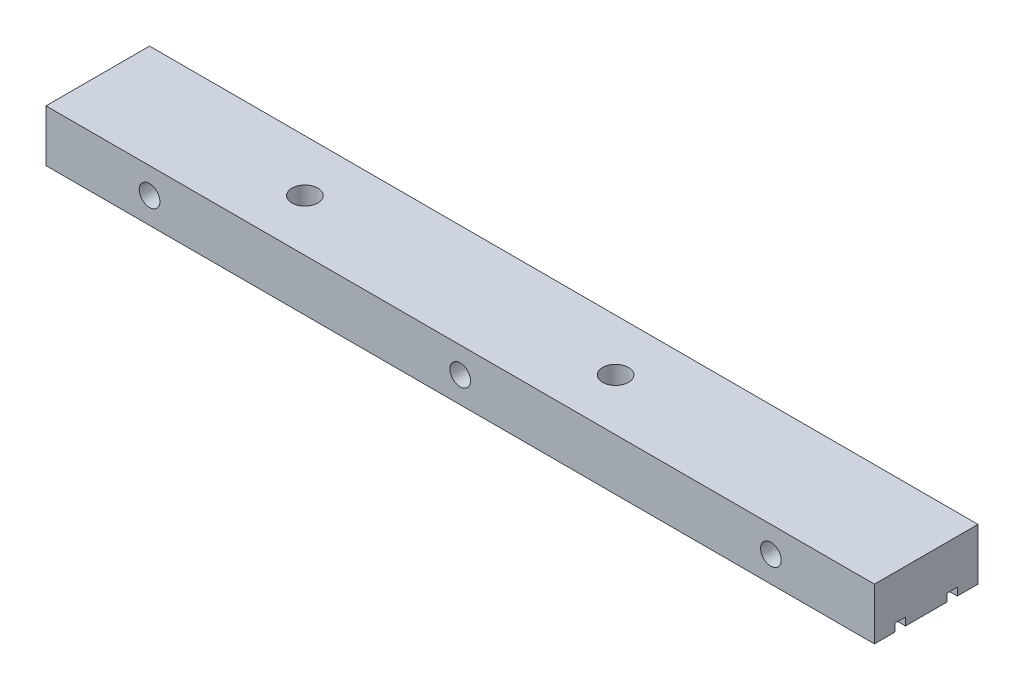
from build123d import *

# Parameters (mm, degrees)
IZIM1_W                                      = 160
IZIM1_H                                      = 10
Y_KSEKLIK_EKSTR_ZYON1_DEPTH                  = 20
F_4_0MM_SAPLAMA_DELIKLERI1_D                 = 5
F_4_0MM_SAPLAMA_DELIKLERI1_DEPTH             = 8
IZIM6_W                                      = 2
IZIM6_H                                      = 1.5
KES_EKSTR_ZYON1_DEPTH                        = 162.554944214
M5_ALT_GEN_BA_L_C_VATA_IN_HAV_A1_D           = 4
M5_ALT_GEN_BA_L_C_VATA_IN_HAV_A1_CBORE_D     = 6.5
M5_ALT_GEN_BA_L_C_VATA_IN_HAV_A1_CBORE_DEPTH = 6


with BuildPart() as part:
    # Çizim1 → Yükseklik-Ekstrüzyon1 (new body)
    with BuildSketch(Plane.XY):
        with Locations((80, 5)):
            Rectangle(IZIM1_W, IZIM1_H)
    extrude(amount=Y_KSEKLIK_EKSTR_ZYON1_DEPTH)

    # Ø4.0mm Saplama Delikleri1
    with Locations(Plane(origin=(40, 10, 10), x_dir=(0, 0, 1), z_dir=(0, 1, 0))):
        with Locations((0, 0), (0, 60)):
            Hole(F_4_0MM_SAPLAMA_DELIKLERI1_D / 2, depth=F_4_0MM_SAPLAMA_DELIKLERI1_DEPTH)

    # Çizim6 → Kes-Ekstrüzyon1 (cut, through all)
    with BuildSketch(Plane.ZY):
        with Locations((5, 0.75)):
            Rectangle(IZIM6_W, IZIM6_H)
        with Locations((15, 0.75)):
            Rectangle(IZIM6_W, IZIM6_H)
    extrude(amount=-KES_EKSTR_ZYON1_DEPTH, mode=Mode.SUBTRACT)

    # M5 Altıgen Başlı Cıvata İçin Havşa1 (through all)
    with Locations(Plane(origin=(140, 5, 0), x_dir=(-1, 0, 0), z_dir=(0, 0, -1))):
        with Locations((0, 0), (60, 0), (120, 0)):
            CounterBoreHole(M5_ALT_GEN_BA_L_C_VATA_IN_HAV_A1_D / 2, M5_ALT_GEN_BA_L_C_VATA_IN_HAV_A1_CBORE_D / 2, M5_ALT_GEN_BA_L_C_VATA_IN_HAV_A1_CBORE_DEPTH)


solid = part.part
